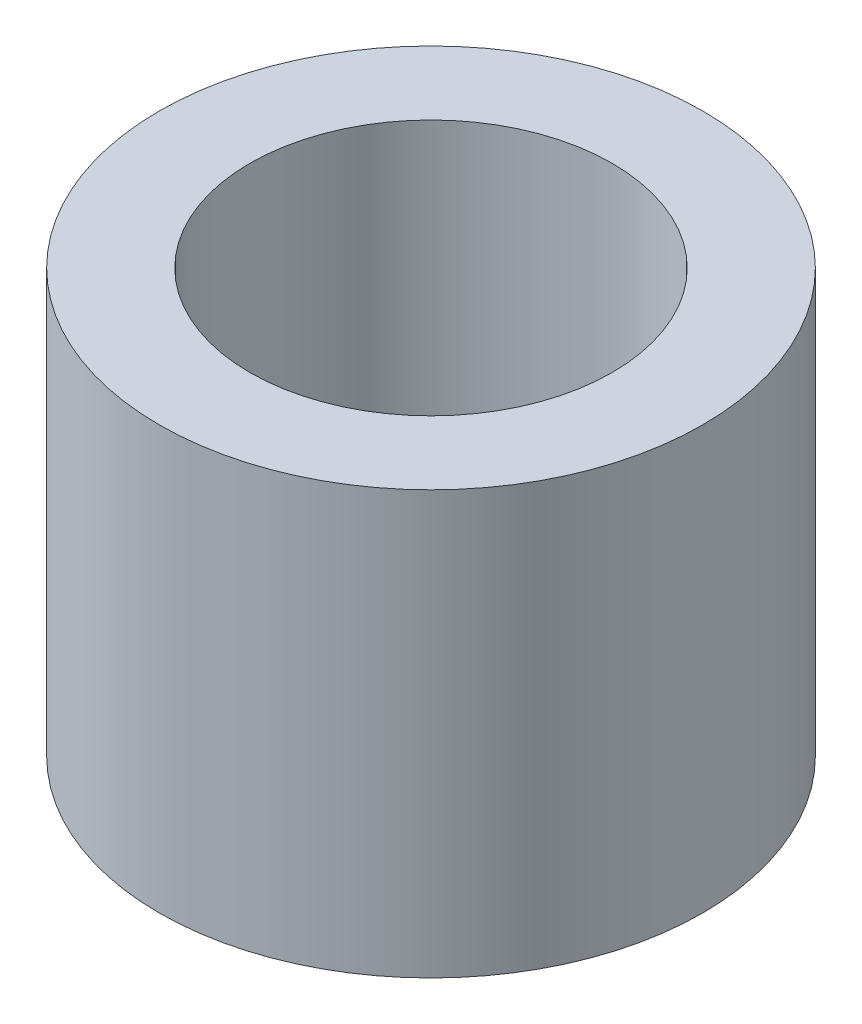
from build123d import *

# Parameters (mm, degrees)
SKETCH1_W = 3
SKETCH1_H = 14


with BuildPart() as part:
    # Sketch1 → Revolve1 (revolve)
    with BuildSketch(Plane(origin=(0, 0, 0), x_dir=(0, 0, -1), z_dir=(1, 0, 0))):
        with Locations((-7.5, 0)):
            Rectangle(SKETCH1_W, SKETCH1_H)
    revolve(axis=Axis((0, 15.507800407, 0), (0, -1, 0)))


solid = part.part
